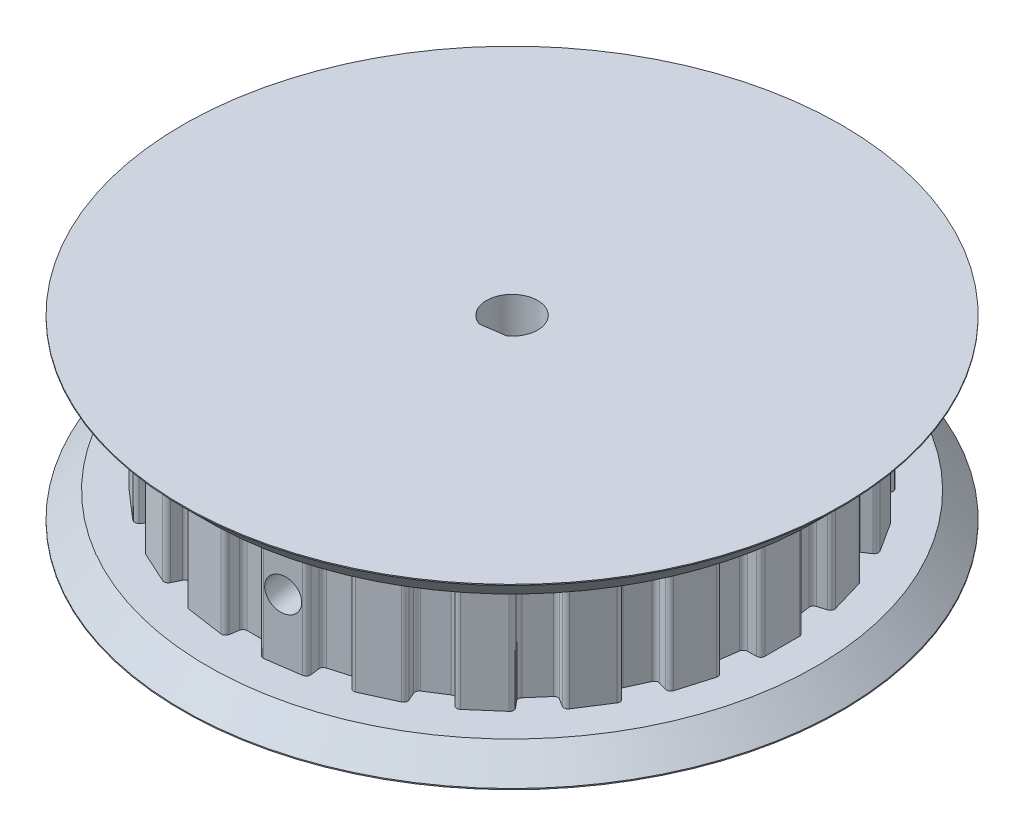
from build123d import *

# Parameters (mm, degrees)
BOSS_EXTRUDE1_DEPTH = 15.24
BOSS_EXTRUDE2_START = 15.24
SKETCH3_R           = 40.005
BOSS_EXTRUDE2_DEPTH = 3.175
BOSS_EXTRUDE3_START = 3.175
SKETCH4_R           = 40.005
BOSS_EXTRUDE3_DEPTH = 3.175
CHAMFER1_SIZE       = 3.048
CHAMFER2_SIZE       = 3.048
SKETCH5_R           = 3.1115
CUT_EXTRUDE1_DEPTH  = 61.555166171
BOSS_EXTRUDE4_DEPTH = 21.59
SKETCH10_R          = 1.984375
CUT_EXTRUDE3_DEPTH  = 60.497161907


with BuildPart() as part:
    # Sketch1 → Boss-Extrude1 (new body)
    with BuildSketch(Plane(origin=(0, 0, 0), x_dir=(1, 0, 0), z_dir=(0, 1, 0))):
        with BuildLine():
            Line((24.817817728, 19.061751667), (25.750980162, 19.641247532))
            ThreePointArc((25.750980162, 19.641247532), (26.130799643, 19.705230755), (26.446334633, 19.484336298))
            Line((26.446334633, 19.484336298), (28.70978015, 15.962346326))
            ThreePointArc((28.70978015, 15.962346326), (28.779634844, 15.58356273), (28.563650943, 15.264646368))
            Line((28.563650943, 15.264646368), (27.648873278, 14.656543244))
            ThreePointArc((27.648873278, 14.656543244), (27.441585339, 14.372832212), (27.468007812, 14.022457995))
            Line((27.468007812, 14.022457995), (28.585186417, 11.576178078))
            ThreePointArc((28.585186417, 11.576178078), (28.832678543, 11.326762988), (29.182837766, 11.297629546))
            Line((29.182837766, 11.297629546), (30.241463416, 11.590749518))
            ThreePointArc((30.241463416, 11.590749518), (30.623923696, 11.545133457), (30.864444142, 11.244290298))
            Line((30.864444142, 11.244290298), (32.043944972, 7.227279374))
            ThreePointArc((32.043944972, 7.227279374), (32.004254389, 6.844158833), (31.707170231, 6.599010522))
            Line((31.707170231, 6.599010522), (30.658125041, 6.273262498))
            ThreePointArc((30.658125041, 6.273262498), (30.379303086, 6.059443517), (30.305943439, 5.715817847))
            Line((30.305943439, 5.715817847), (30.688671765, 3.05388387))
            ThreePointArc((30.688671765, 3.05388387), (30.85587037, 2.744845255), (31.183637845, 2.618240668))
            Line((31.183637845, 2.618240668), (32.281963157, 2.601237911))
            ThreePointArc((32.281963157, 2.601237911), (32.636079579, 2.449718108), (32.782099944, 2.093298771))
            Line((32.782099944, 2.093298771), (32.782099944, -2.093298771))
            ThreePointArc((32.782099944, -2.093298771), (32.636079579, -2.449718108), (32.281963157, -2.601237911))
            Line((32.281963157, -2.601237911), (31.183637845, -2.618240668))
            ThreePointArc((31.183637845, -2.618240668), (30.85587037, -2.744845255), (30.688671765, -3.05388387))
            Line((30.688671765, -3.05388387), (30.305943439, -5.715817847))
            ThreePointArc((30.305943439, -5.715817847), (30.379303086, -6.059443517), (30.658125041, -6.273262498))
            Line((30.658125041, -6.273262498), (31.707170231, -6.599010522))
            ThreePointArc((31.707170231, -6.599010522), (32.004254389, -6.844158833), (32.043944972, -7.227279374))
            Line((32.043944972, -7.227279374), (30.864444142, -11.244290298))
            ThreePointArc((30.864444142, -11.244290298), (30.623923696, -11.545133457), (30.241463416, -11.590749518))
            Line((30.241463416, -11.590749518), (29.182837766, -11.297629546))
            ThreePointArc((29.182837766, -11.297629546), (28.832678543, -11.326762988), (28.585186417, -11.576178078))
            Line((28.585186417, -11.576178078), (27.468007812, -14.022457995))
            ThreePointArc((27.468007812, -14.022457995), (27.441585339, -14.372832212), (27.648873278, -14.656543244))
            Line((27.648873278, -14.656543244), (28.563650943, -15.264646368))
            ThreePointArc((28.563650943, -15.264646368), (28.779634844, -15.58356273), (28.70978015, -15.962346326))
            Line((28.70978015, -15.962346326), (26.446334633, -19.484336298))
            ThreePointArc((26.446334633, -19.484336298), (26.130799643, -19.705230755), (25.750980162, -19.641247532))
            Line((25.750980162, -19.641247532), (24.817817728, -19.061751667))
            ThreePointArc((24.817817728, -19.061751667), (24.473634575, -18.991053747), (24.165899268, -19.160639184))
            Line((24.165899268, -19.160639184), (22.404777551, -21.193081992))
            ThreePointArc((22.404777551, -21.193081992), (22.28071355, -21.52181952), (22.399674236, -21.852438022))
            Line((22.399674236, -21.852438022), (23.10607453, -22.693631348))
            ThreePointArc((23.10607453, -22.693631348), (23.223460444, -23.060479052), (23.049719685, -23.40423891))
            Line((23.049719685, -23.40423891), (19.885700375, -26.145877249))
            ThreePointArc((19.885700375, -26.145877249), (19.520713609, -26.268927449), (19.174305643, -26.100528483))
            Line((19.174305643, -26.100528483), (18.442205696, -25.281604033))
            ThreePointArc((18.442205696, -25.281604033), (18.131882284, -25.116802276), (17.788834681, -25.192819256))
            Line((17.788834681, -25.192819256), (15.526445458, -26.646768525))
            ThreePointArc((15.526445458, -26.646768525), (15.314790857, -26.927237006), (15.335786804, -27.277978234))
            Line((15.335786804, -27.277978234), (15.776581376, -28.28411328))
            ThreePointArc((15.776581376, -28.28411328), (15.785859393, -28.669172509), (15.522308012, -28.950059248))
            Line((15.522308012, -28.950059248), (11.714044937, -30.68923472))
            ThreePointArc((11.714044937, -30.68923472), (11.329175452, -30.704471868), (11.044242914, -30.445299841))
            Line((11.044242914, -30.445299841), (10.572515838, -29.453291196))
            ThreePointArc((10.572515838, -29.453291196), (10.321192725, -29.20773686), (9.970624502, -29.18402694))
            Line((9.970624502, -29.18402694), (7.390253094, -29.941692347))
            ThreePointArc((7.390253094, -29.941692347), (7.108154889, -30.151169891), (7.02948513, -30.493618877))
            Line((7.02948513, -30.493618877), (7.168963425, -31.583184566))
            ThreePointArc((7.168963425, -31.583184566), (7.069381897, -31.95526011), (6.737371259, -32.150517959))
            Line((6.737371259, -32.150517959), (2.593387244, -32.746332911))
            ThreePointArc((2.593387244, -32.746332911), (2.219814877, -32.652522583), (2.019441306, -32.323574072))
            Line((2.019441306, -32.323574072), (1.846303624, -31.238847872))
            ThreePointArc((1.846303624, -31.238847872), (1.674341514, -30.932434308), (1.344653624, -30.810918325))
            Line((1.344653624, -30.810918325), (-1.344653624, -30.810918325))
            ThreePointArc((-1.344653624, -30.810918325), (-1.674341514, -30.932434308), (-1.846303624, -31.238847872))
            Line((-1.846303624, -31.238847872), (-2.019441306, -32.323574072))
            ThreePointArc((-2.019441306, -32.323574072), (-2.219814877, -32.652522583), (-2.593387244, -32.746332911))
            Line((-2.593387244, -32.746332911), (-7.23247669, -32.079332544))
            Line((-7.23247669, -32.079332544), (-7.02948513, -30.493618877))
            ThreePointArc((-7.02948513, -30.493618877), (-7.108154889, -30.151169891), (-7.390253094, -29.941692347))
            Line((-7.390253094, -29.941692347), (-9.970624502, -29.18402694))
            ThreePointArc((-9.970624502, -29.18402694), (-10.321192725, -29.20773686), (-10.572515838, -29.453291196))
            Line((-10.572515838, -29.453291196), (-11.044242914, -30.445299841))
            ThreePointArc((-11.044242914, -30.445299841), (-11.329175452, -30.704471868), (-11.714044937, -30.68923472))
            Line((-11.714044937, -30.68923472), (-15.522308012, -28.950059248))
            ThreePointArc((-15.522308012, -28.950059248), (-15.785859393, -28.669172509), (-15.776581376, -28.28411328))
            Line((-15.776581376, -28.28411328), (-15.161891288, -26.881053264))
            Line((-15.161891288, -26.881053264), (-17.788834681, -25.192819256))
            ThreePointArc((-17.788834681, -25.192819256), (-18.131882284, -25.116802276), (-18.442205696, -25.281604033))
            Line((-18.442205696, -25.281604033), (-19.174305643, -26.100528483))
            ThreePointArc((-19.174305643, -26.100528483), (-19.520713609, -26.268927449), (-19.885700375, -26.145877249))
            Line((-19.885700375, -26.145877249), (-23.427743137, -23.076679724))
            Line((-23.427743137, -23.076679724), (-22.120996025, -21.520583331))
            Line((-22.120996025, -21.520583331), (-24.165899268, -19.160639184))
            ThreePointArc((-24.165899268, -19.160639184), (-24.473634575, -18.991053747), (-24.817817728, -19.061751667))
            Line((-24.817817728, -19.061751667), (-26.175907874, -19.905128549))
            Line((-26.175907874, -19.905128549), (-28.70978015, -15.962346326))
            ThreePointArc((-28.70978015, -15.962346326), (-28.779634844, -15.58356273), (-28.563650943, -15.264646368))
            Line((-28.563650943, -15.264646368), (-27.648873278, -14.656543244))
            ThreePointArc((-27.648873278, -14.656543244), (-27.441585339, -14.372832212), (-27.468007812, -14.022457995))
            Line((-27.468007812, -14.022457995), (-28.585186417, -11.576178078))
            ThreePointArc((-28.585186417, -11.576178078), (-28.832678543, -11.326762988), (-29.182837766, -11.297629546))
            Line((-29.182837766, -11.297629546), (-30.241463416, -11.590749518))
            ThreePointArc((-30.241463416, -11.590749518), (-30.623923696, -11.545133457), (-30.864444142, -11.244290298))
            Line((-30.864444142, -11.244290298), (-32.043944972, -7.227279374))
            ThreePointArc((-32.043944972, -7.227279374), (-32.004254389, -6.844158833), (-31.707170231, -6.599010522))
            Line((-31.707170231, -6.599010522), (-30.658125041, -6.273262498))
            ThreePointArc((-30.658125041, -6.273262498), (-30.379303086, -6.059443517), (-30.305943439, -5.715817847))
            Line((-30.305943439, -5.715817847), (-30.688671765, -3.05388387))
            ThreePointArc((-30.688671765, -3.05388387), (-30.85587037, -2.744845255), (-31.183637845, -2.618240668))
            Line((-31.183637845, -2.618240668), (-32.281963157, -2.601237911))
            ThreePointArc((-32.281963157, -2.601237911), (-32.636079579, -2.449718108), (-32.782099944, -2.093298771))
            Line((-32.782099944, -2.093298771), (-32.782099944, 2.093298771))
            ThreePointArc((-32.782099944, 2.093298771), (-32.636079579, 2.449718108), (-32.281963157, 2.601237911))
            Line((-32.281963157, 2.601237911), (-31.183637845, 2.618240668))
            ThreePointArc((-31.183637845, 2.618240668), (-30.85587037, 2.744845255), (-30.688671765, 3.05388387))
            Line((-30.688671765, 3.05388387), (-30.305943439, 5.715817847))
            ThreePointArc((-30.305943439, 5.715817847), (-30.379303086, 6.059443517), (-30.658125041, 6.273262498))
            Line((-30.658125041, 6.273262498), (-31.707170231, 6.599010522))
            ThreePointArc((-31.707170231, 6.599010522), (-32.004254389, 6.844158833), (-32.043944972, 7.227279374))
            Line((-32.043944972, 7.227279374), (-30.864444142, 11.244290298))
            ThreePointArc((-30.864444142, 11.244290298), (-30.623923696, 11.545133457), (-30.241463416, 11.590749518))
            Line((-30.241463416, 11.590749518), (-29.182837766, 11.297629546))
            ThreePointArc((-29.182837766, 11.297629546), (-28.832678543, 11.326762988), (-28.585186417, 11.576178078))
            Line((-28.585186417, 11.576178078), (-27.468007812, 14.022457995))
            ThreePointArc((-27.468007812, 14.022457995), (-27.441585339, 14.372832212), (-27.648873278, 14.656543244))
            Line((-27.648873278, 14.656543244), (-28.563650943, 15.264646368))
            ThreePointArc((-28.563650943, 15.264646368), (-28.779634844, 15.58356273), (-28.70978015, 15.962346326))
            Line((-28.70978015, 15.962346326), (-26.446334633, 19.484336298))
            ThreePointArc((-26.446334633, 19.484336298), (-26.130799643, 19.705230755), (-25.750980162, 19.641247532))
            Line((-25.750980162, 19.641247532), (-24.817817728, 19.061751667))
            ThreePointArc((-24.817817728, 19.061751667), (-24.473634575, 18.991053747), (-24.165899268, 19.160639184))
            Line((-24.165899268, 19.160639184), (-22.404777551, 21.193081992))
            ThreePointArc((-22.404777551, 21.193081992), (-22.28071355, 21.52181952), (-22.399674236, 21.852438022))
            Line((-22.399674236, 21.852438022), (-23.10607453, 22.693631348))
            ThreePointArc((-23.10607453, 22.693631348), (-23.223460444, 23.060479052), (-23.049719685, 23.40423891))
            Line((-23.049719685, 23.40423891), (-19.885700375, 26.145877249))
            ThreePointArc((-19.885700375, 26.145877249), (-19.520713609, 26.268927449), (-19.174305643, 26.100528483))
            Line((-19.174305643, 26.100528483), (-18.442205696, 25.281604033))
            ThreePointArc((-18.442205696, 25.281604033), (-18.131882284, 25.116802276), (-17.788834681, 25.192819256))
            Line((-17.788834681, 25.192819256), (-15.526445458, 26.646768525))
            ThreePointArc((-15.526445458, 26.646768525), (-15.314790857, 26.927237006), (-15.335786804, 27.277978234))
            Line((-15.335786804, 27.277978234), (-15.776581376, 28.28411328))
            ThreePointArc((-15.776581376, 28.28411328), (-15.785859393, 28.669172509), (-15.522308012, 28.950059248))
            Line((-15.522308012, 28.950059248), (-11.714044937, 30.68923472))
            ThreePointArc((-11.714044937, 30.68923472), (-11.329175452, 30.704471868), (-11.044242914, 30.445299841))
            Line((-11.044242914, 30.445299841), (-10.572515838, 29.453291196))
            ThreePointArc((-10.572515838, 29.453291196), (-10.321192725, 29.20773686), (-9.970624502, 29.18402694))
            Line((-9.970624502, 29.18402694), (-7.390253094, 29.941692347))
            ThreePointArc((-7.390253094, 29.941692347), (-7.108154889, 30.151169891), (-7.02948513, 30.493618877))
            Line((-7.02948513, 30.493618877), (-7.168963425, 31.583184566))
            ThreePointArc((-7.168963425, 31.583184566), (-7.069381897, 31.95526011), (-6.737371259, 32.150517959))
            Line((-6.737371259, 32.150517959), (-2.593387244, 32.746332911))
            ThreePointArc((-2.593387244, 32.746332911), (-2.219814877, 32.652522583), (-2.019441306, 32.323574072))
            Line((-2.019441306, 32.323574072), (-1.846303624, 31.238847872))
            ThreePointArc((-1.846303624, 31.238847872), (-1.674341514, 30.932434308), (-1.344653624, 30.810918325))
            Line((-1.344653624, 30.810918325), (1.344653624, 30.810918325))
            ThreePointArc((1.344653624, 30.810918325), (1.674341514, 30.932434308), (1.846303624, 31.238847872))
            Line((1.846303624, 31.238847872), (2.019441306, 32.323574072))
            ThreePointArc((2.019441306, 32.323574072), (2.219814877, 32.652522583), (2.593387244, 32.746332911))
            Line((2.593387244, 32.746332911), (6.737371259, 32.150517959))
            ThreePointArc((6.737371259, 32.150517959), (7.069381897, 31.95526011), (7.168963425, 31.583184566))
            Line((7.168963425, 31.583184566), (7.02948513, 30.493618877))
            ThreePointArc((7.02948513, 30.493618877), (7.108154889, 30.151169891), (7.390253094, 29.941692347))
            Line((7.390253094, 29.941692347), (9.970624502, 29.18402694))
            ThreePointArc((9.970624502, 29.18402694), (10.321192725, 29.20773686), (10.572515838, 29.453291196))
            Line((10.572515838, 29.453291196), (11.044242914, 30.445299841))
            ThreePointArc((11.044242914, 30.445299841), (11.329175452, 30.704471868), (11.714044937, 30.68923472))
            Line((11.714044937, 30.68923472), (15.522308012, 28.950059248))
            ThreePointArc((15.522308012, 28.950059248), (15.785859393, 28.669172509), (15.776581376, 28.28411328))
            Line((15.776581376, 28.28411328), (15.335786804, 27.277978234))
            ThreePointArc((15.335786804, 27.277978234), (15.314790857, 26.927237006), (15.526445458, 26.646768525))
            Line((15.526445458, 26.646768525), (17.788834681, 25.192819256))
            ThreePointArc((17.788834681, 25.192819256), (18.131882284, 25.116802276), (18.442205696, 25.281604033))
            Line((18.442205696, 25.281604033), (19.174305643, 26.100528483))
            ThreePointArc((19.174305643, 26.100528483), (19.520713609, 26.268927449), (19.885700375, 26.145877249))
            Line((19.885700375, 26.145877249), (23.049719685, 23.40423891))
            ThreePointArc((23.049719685, 23.40423891), (23.223460444, 23.060479052), (23.10607453, 22.693631348))
            Line((23.10607453, 22.693631348), (22.399674236, 21.852438022))
            ThreePointArc((22.399674236, 21.852438022), (22.28071355, 21.52181952), (22.404777551, 21.193081992))
            Line((22.404777551, 21.193081992), (24.165899268, 19.160639184))
            ThreePointArc((24.165899268, 19.160639184), (24.473634575, 18.991053747), (24.817817728, 19.061751667))
        make_face()
    extrude(amount=BOSS_EXTRUDE1_DEPTH)

    # Sketch3 → Boss-Extrude2 (add)
    with BuildSketch(Plane(origin=(0, 0, 0), x_dir=(1, 0, 0), z_dir=(0, 1, 0)).offset(BOSS_EXTRUDE2_START)):
        with Locations(Location((0, 0, 0), (0, 0, 90))):
            Circle(SKETCH3_R)
    extrude(amount=BOSS_EXTRUDE2_DEPTH)

    # Sketch4 → Boss-Extrude3 (add)
    with BuildSketch(Plane.XZ.offset(BOSS_EXTRUDE3_START)):
        with Locations(Location((0, 0, 0), (0, 0, 270))):
            Circle(SKETCH4_R)
    extrude(amount=-BOSS_EXTRUDE3_DEPTH)

    # Chamfer1
    chamfer1_edges = [part.edges().sort_by_distance(p)[0] for p in [
        (0, 15.24, 40.005),
    ]]
    chamfer(chamfer1_edges, length=CHAMFER1_SIZE)

    # Chamfer2
    chamfer2_edges = [part.edges().sort_by_distance(p)[0] for p in [
        (0, 0, 40.005),
    ]]
    chamfer(chamfer2_edges, length=CHAMFER2_SIZE)

    # Sketch5 → Cut-Extrude1 (cut, through all)
    with BuildSketch(Plane.XZ.offset(3.175)):
        with Locations(Location((0, 0, 0), (0, 0, 270))):
            Circle(SKETCH5_R)
    extrude(amount=-CUT_EXTRUDE1_DEPTH, mode=Mode.SUBTRACT)

    # Sketch11 → Boss-Extrude4 (add)
    with BuildSketch(Plane.XZ.offset(3.175)):
        with BuildLine():
            ThreePointArc((1.865317347, 2.490386204), (0.442812619, 3.079829416), (-1.088136015, 2.91502869))
            Line((-1.088136015, 2.91502869), (1.865317347, 2.490386204))
        make_face()
    extrude(amount=-BOSS_EXTRUDE4_DEPTH)

    # Sketch10 → Cut-Extrude3 (cut, through all)
    with BuildSketch(Plane(origin=(0, 0, 0), x_dir=(0.989821441880933, 0, -0.1423148382732839), z_dir=(0.1423148382732839, 0, 0.989821441880933))):
        with Locations(Location((0, 7.62, 0), (0, 0, 180))):
            Circle(SKETCH10_R)
    extrude(amount=CUT_EXTRUDE3_DEPTH, mode=Mode.SUBTRACT)


solid = part.part
